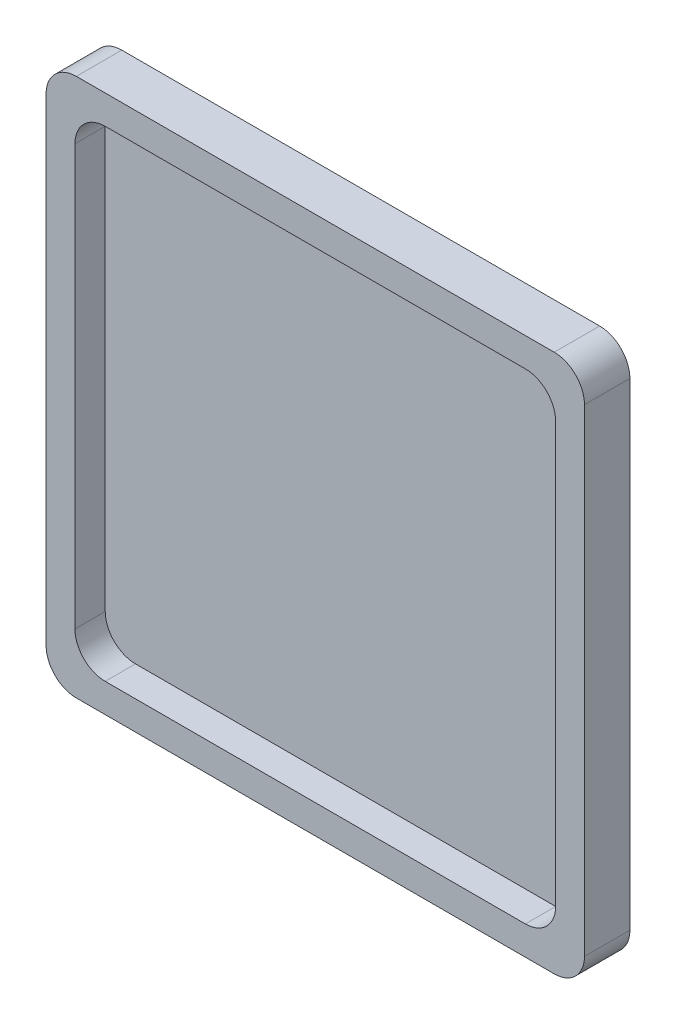
from build123d import *

# Parameters (mm, degrees)
SKETCH1_W           = 177.8
SKETCH1_H           = 177.8
BOSS_EXTRUDE1_DEPTH = 15
SKETCH2_W           = 158.75
SKETCH2_H           = 158.75
CUT_EXTRUDE1_DEPTH  = 10
FILLET1_R           = 10
SKETCH3_W           = 63.5
SKETCH3_H           = 63.5
BOSS_EXTRUDE2_DEPTH = 10


with BuildPart() as part:
    # Sketch1 → Boss-Extrude1 (new body)
    with BuildSketch(Plane.XY):
        with Locations((97.785967035, 49.382663919)):
            Rectangle(SKETCH1_W, SKETCH1_H)
    extrude(amount=BOSS_EXTRUDE1_DEPTH)

    # Sketch2 → Cut-Extrude1 (cut)
    with BuildSketch(Plane.XY.offset(15)):
        with Locations((97.785967035, 49.382663919)):
            Rectangle(SKETCH2_W, SKETCH2_H)
    extrude(amount=-CUT_EXTRUDE1_DEPTH, mode=Mode.SUBTRACT)

    # Fillet1
    fillet1_edges = [part.edges().sort_by_distance(p)[0] for p in [
        (177.160967035, 128.757663919, 10),
        (177.160967035, -29.992336081, 10),
        (18.410967035, -29.992336081, 10),
        (18.410967035, 128.757663919, 10),
        (8.885967035, 138.282663919, 7.5),
        (186.685967035, 138.282663919, 7.5),
        (186.685967035, -39.517336081, 7.5),
        (8.885967035, -39.517336081, 7.5),
    ]]
    fillet(fillet1_edges, radius=FILLET1_R)

    # Sketch3 → Boss-Extrude2 (add)
    with BuildSketch(Plane(origin=(0, 0, 0), x_dir=(-1, 0, 0), z_dir=(0, 0, -1))):
        with Locations((-97.785967035, 49.382663919)):
            Rectangle(SKETCH3_W, SKETCH3_H)
    extrude(amount=BOSS_EXTRUDE2_DEPTH)


solid = part.part
